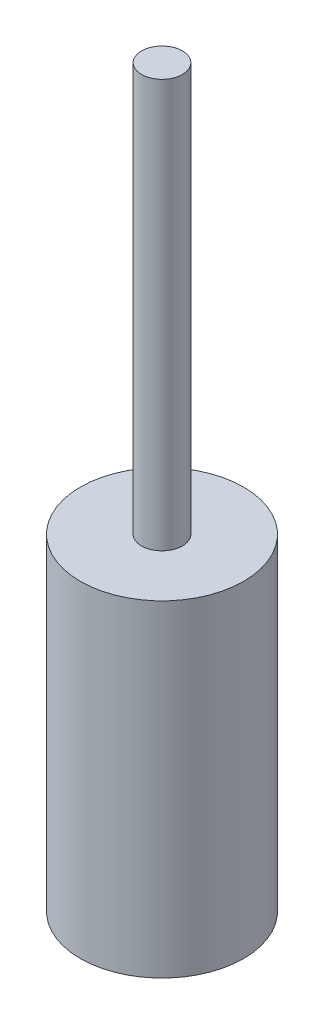
from build123d import *

# Parameters (mm, degrees)
SKETCH2_R           = 10
SKETCH2_R_2         = 2.5
BOSS_EXTRUDE1_DEPTH = 40
BOSS_EXTRUDE2_START = 40
SKETCH2_3_R         = 2.5
BOSS_EXTRUDE2_DEPTH = 50
SKETCH3_R           = 5
CUT_EXTRUDE1_DEPTH  = 20


with BuildPart() as part:
    # Sketch2 → Boss-Extrude1 (new body)
    # profile 1 of 2: a face of its own
    with BuildSketch(Plane(origin=(0, 0, 0), x_dir=(1, 0, 0), z_dir=(0, 1, 0))):
        with Locations(Location((0, 0, 0), (0, 0, 270))):
            Circle(SKETCH2_R)
        Circle(SKETCH2_R_2, mode=Mode.SUBTRACT)
    # profile 2 of 2: a face of its own
    with BuildSketch(Plane(origin=(0, 0, 0), x_dir=(1, 0, 0), z_dir=(0, 1, 0))):
        Circle(SKETCH2_R_2)
    extrude(amount=BOSS_EXTRUDE1_DEPTH)

    # Sketch2<3> → Boss-Extrude2 (add)
    with BuildSketch(Plane(origin=(0, 0, 0), x_dir=(1, 0, 0), z_dir=(0, 1, 0)).offset(BOSS_EXTRUDE2_START)):
        with Locations(Location((0, 0, 0), (0, 0, 270))):
            Circle(SKETCH2_3_R)
    extrude(amount=BOSS_EXTRUDE2_DEPTH)

    # Sketch3 → Cut-Extrude1 (cut)
    with BuildSketch(Plane(origin=(0, 0, 0), x_dir=(1, 0, 0), z_dir=(0, 1, 0))):
        with Locations(Location((0, 0, 0), (0, 0, 270))):
            Circle(SKETCH3_R)
    extrude(amount=CUT_EXTRUDE1_DEPTH, mode=Mode.SUBTRACT)


solid = part.part
